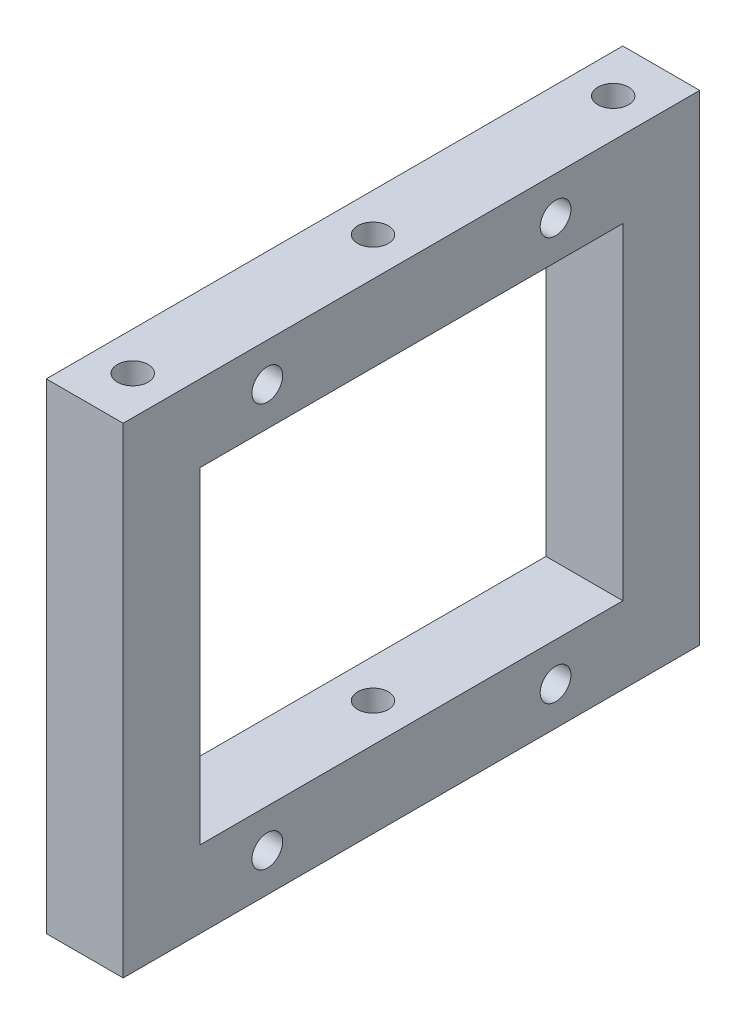
from build123d import *

# Parameters (mm, degrees)
SKETCH_1_W          = 60
SKETCH_1_H          = 50
SKETCH_1_R          = 1.6
SKETCH_1_W_2        = 44
SKETCH_1_H_2        = 34
EXTRUDE_1_DEPTH     = 8
SKETCH_2_R          = 1.6
CUT_EXTRUDE_1_DEPTH = 10
CUT_EXTRUDE_START   = -40
SKETCH_2_2_R        = 1.6
CUT_EXTRUDE_2_DEPTH = 10


with BuildPart() as part:
    # 草图1 → 凸台-拉伸1 (new body)
    with BuildSketch(Plane(origin=(0, 0, 0), x_dir=(0, 0, -1), z_dir=(1, 0, 0))):
        with Locations((30, 25)):
            Rectangle(SKETCH_1_W, SKETCH_1_H)
        with Locations((15, 46)):
            Circle(SKETCH_1_R, mode=Mode.SUBTRACT)
        with Locations((45, 46)):
            Circle(SKETCH_1_R, mode=Mode.SUBTRACT)
        with Locations((15, 4)):
            Circle(SKETCH_1_R, mode=Mode.SUBTRACT)
        with Locations((45, 4)):
            Circle(SKETCH_1_R, mode=Mode.SUBTRACT)
        with Locations((30, 25)):
            Rectangle(SKETCH_1_W_2, SKETCH_1_H_2, mode=Mode.SUBTRACT)
    extrude(amount=EXTRUDE_1_DEPTH)

    # 草图2 → 切除-拉伸1 (cut)
    with BuildSketch(Plane.XZ):
        with Locations(Location((4, -5, 0), (0, 0, 270))):
            Circle(SKETCH_2_R)
        with Locations(Location((4, -30, 0), (0, 0, 270))):
            Circle(SKETCH_2_R)
        with Locations(Location((4, -55, 0), (0, 0, 270))):
            Circle(SKETCH_2_R)
    extrude(amount=-CUT_EXTRUDE_1_DEPTH, mode=Mode.SUBTRACT)

    # 草图2<2> → 切除-拉伸2 (cut)
    with BuildSketch(Plane.XZ.offset(CUT_EXTRUDE_START)):
        with Locations(Location((4, -5, 0), (0, 0, 270))):
            Circle(SKETCH_2_2_R)
        with Locations(Location((4, -30, 0), (0, 0, 270))):
            Circle(SKETCH_2_2_R)
        with Locations(Location((4, -55, 0), (0, 0, 270))):
            Circle(SKETCH_2_2_R)
    extrude(amount=-CUT_EXTRUDE_2_DEPTH, mode=Mode.SUBTRACT)


solid = part.part
